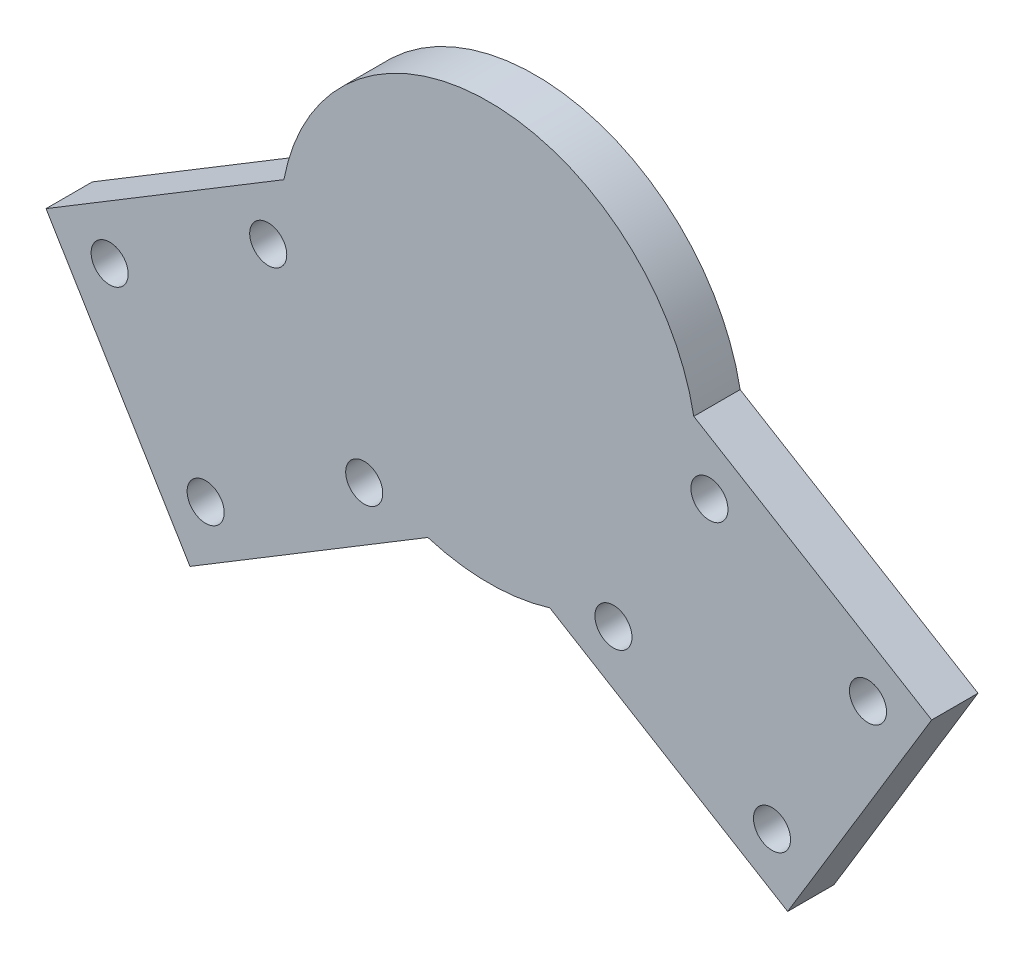
from build123d import *

# Parameters (mm, degrees)
BOSS_EXTRUDE1_DEPTH = 5
SKETCH4_R           = 2
CUT_EXTRUDE1_DEPTH  = 10


with BuildPart() as part:
    # Sketch2 → Boss-Extrude1 (new body)
    with BuildSketch(Plane.XY):
        with BuildLine():
            Line((6.578363356, -21.516857009), (32.24208854, -37.05304733))
            Line((32.24208854, -37.05304733), (47.778278861, -11.389322146))
            Line((47.778278861, -11.389322146), (22.114553677, 4.146868175))
            ThreePointArc((22.114553677, 4.146868175), (0, 22.5), (-22.114553677, 4.146868175))
            Line((-22.114553677, 4.146868175), (-47.778278861, -11.389322146))
            Line((-47.778278861, -11.389322146), (-32.24208854, -37.05304733))
            Line((-32.24208854, -37.05304733), (-6.578363356, -21.516857009))
            ThreePointArc((-6.578363356, -21.516857009), (0, -22.5), (6.578363356, -21.516857009))
        make_face()
    extrude(amount=BOSS_EXTRUDE1_DEPTH)

    # Sketch4 → Cut-Extrude1 (cut)
    with BuildSketch(Plane.XY.offset(5)):
        with Locations((-40.911626277, -13.077244623)):
            Circle(SKETCH4_R)
        with Locations((-23.802476154, -2.719784409)):
            Circle(SKETCH4_R)
        with Locations((-13.44501594, -19.828934532)):
            Circle(SKETCH4_R)
        with Locations((-30.554166063, -30.186394746)):
            Circle(SKETCH4_R)
        with Locations((23.802476154, -2.719784409)):
            Circle(SKETCH4_R)
        with Locations((13.44501594, -19.828934532)):
            Circle(SKETCH4_R)
        with Locations((40.911626277, -13.077244623)):
            Circle(SKETCH4_R)
        with Locations((30.554166063, -30.186394746)):
            Circle(SKETCH4_R)
    extrude(amount=-CUT_EXTRUDE1_DEPTH, mode=Mode.SUBTRACT)


solid = part.part
